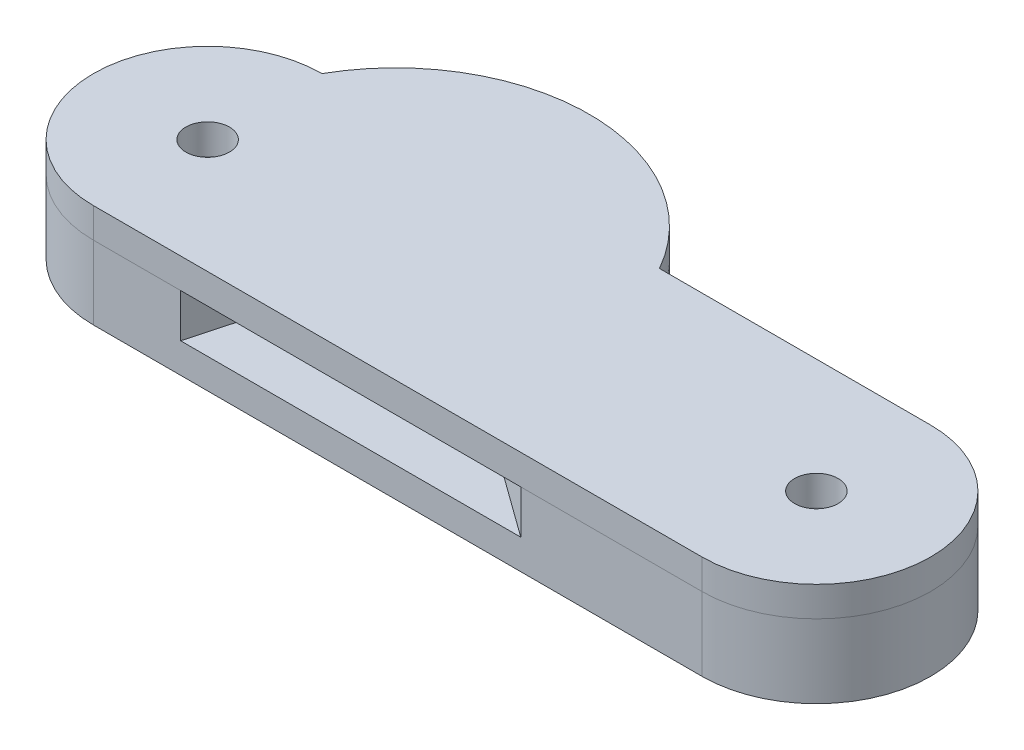
from build123d import *

# Parameters (mm, degrees)
SKETCH1_R                       = 2
BOSS_EXTRUDE1_DEPTH             = 4.75
CUT_EXTRUDE1_DEPTH              = 2
BOSS_EXTRUDE2_REACH             = 69.423
BOSS_EXTRUDE2_DIRECTION_2_REACH = 69.423
CUT_EXTRUDE2_DEPTH              = 2


with BuildPart() as part:
    # Sketch1 → Boss-Extrude1 (new, symmetric)
    with BuildSketch(Plane(origin=(0, 0, 0), x_dir=(1, 0, 0), z_dir=(0, 1, 0))):
        with BuildLine():
            Line((0, -10.500399217), (-55.93053828, -10.500399217))
            ThreePointArc((-55.93053828, -10.500399217), (-66.430937497, 0), (-55.93053828, 10.500399217))
            Line((-55.93053828, 10.500399217), (0, 10.500399217))
            ThreePointArc((0, 10.500399217), (10.500399217, 0), (0, -10.500399217))
        make_face()
        with Locations(Location((0, 0, 0), (0, 0, 270))):
            Circle(SKETCH1_R, mode=Mode.SUBTRACT)
        with Locations(Location((-55.93053828, 0, 0), (0, 0, 270))):
            Circle(SKETCH1_R, mode=Mode.SUBTRACT)
    extrude(amount=BOSS_EXTRUDE1_DEPTH, both=True)

    # Sketch3 → Cut-Extrude1 (cut, symmetric)
    with BuildSketch(Plane(origin=(0, 0, 0), x_dir=(1, 0, 0), z_dir=(0, 1, 0))):
        with BuildLine():
            Line((-35.751827911, 18.875253657), (-39.299525946, 5.868950542))
            Line((-39.299525946, 5.868950542), (26.645239155, -41.810424095))
            ThreePointArc((26.645239155, -41.810424095), (-18.563858299, -45.972421055), (-48.206523525, -11.584965354))
            Line((-48.206523525, -11.584965354), (-43.887265107, 4.249974277))
            Line((-43.887265107, 4.249974277), (-54.812276631, 12.148974547))
            ThreePointArc((-54.812276631, 12.148974547), (-46.585078234, 19.204535889), (-35.751827911, 18.875253657))
        make_face()
    extrude(amount=CUT_EXTRUDE1_DEPTH, both=True, mode=Mode.SUBTRACT)

    # Boss-Extrude2: up to this face of the body (flat: up to its plane)
    boss_extrude2_end = Plane(part.part.faces().sort_by_distance((-27.96526914, 4.75, 0))[0])
    # Sketch5 → Boss-Extrude2 (add, up to the picked face)
    with BuildSketch(Plane(origin=(0, 0, 0), x_dir=(1, 0, 0), z_dir=(0, 1, 0)), mode=Mode.PRIVATE) as boss_extrude2_sk1:
        with BuildLine():
            ThreePointArc((-24.917700351, 10.500399217), (-40.424119316, 19.553005923), (-55.93053828, 10.500399217))
            Line((-55.93053828, 10.500399217), (-24.917700351, 10.500399217))
        make_face()
    boss_extrude2_tool1 = split(extrude(boss_extrude2_sk1.sketch, amount=BOSS_EXTRUDE2_REACH, mode=Mode.PRIVATE), bisect_by=boss_extrude2_end, keep=Keep.BOTH, mode=Mode.PRIVATE)
    add(boss_extrude2_tool1.solids().sort_by(Axis((-40.424119, 0, -14.214125), (0, 1, 0)))[0])

    # Boss-Extrude2 direction 2: up to this face of the body (flat: up to its plane)
    boss_extrude2_direction_2_end = Plane(part.part.faces().sort_by_distance((-27.96526914, -4.75, 0))[0])
    # Sketch5 → Boss-Extrude2 direction 2 (add, up to the picked face)
    with BuildSketch(Plane(origin=(0, 0, 0), x_dir=(1, 0, 0), z_dir=(0, 1, 0)), mode=Mode.PRIVATE) as boss_extrude2_direction_2_sk1:
        with BuildLine():
            ThreePointArc((-24.917700351, 10.500399217), (-40.424119316, 19.553005923), (-55.93053828, 10.500399217))
            Line((-55.93053828, 10.500399217), (-24.917700351, 10.500399217))
        make_face()
    boss_extrude2_direction_2_tool1 = split(extrude(boss_extrude2_direction_2_sk1.sketch, amount=-BOSS_EXTRUDE2_DIRECTION_2_REACH, mode=Mode.PRIVATE), bisect_by=boss_extrude2_direction_2_end, keep=Keep.BOTH, mode=Mode.PRIVATE)
    add(boss_extrude2_direction_2_tool1.solids().sort_by(Axis((-40.424119, 0, -14.214125), (0, -1, 0)))[0])

    # Sketch6 → Cut-Extrude2 (cut, symmetric)
    with BuildSketch(Plane(origin=(0, 0, 0), x_dir=(1, 0, 0), z_dir=(0, 1, 0))):
        with BuildLine():
            Line((-39.299525946, 5.868950542), (-16.659276721, -10.500399217))
            Line((-16.659276721, -10.500399217), (-47.910689027, -10.500399217))
            Line((-47.910689027, -10.500399217), (-43.887265107, 4.249974277))
            Line((-43.887265107, 4.249974277), (-54.854382526, 12.179417945))
            ThreePointArc((-54.854382526, 12.179417945), (-46.349897212, 18.538096729), (-35.738154791, 18.925381021))
            Line((-35.738154791, 18.925381021), (-39.299525946, 5.868950542))
        make_face()
    extrude(amount=CUT_EXTRUDE2_DEPTH, both=True, mode=Mode.SUBTRACT)


with BuildPart() as body_2:
    # Split1: the piece on the far side of the plane
    add(part.part)
    split(bisect_by=Plane(origin=(0, 2, 0), x_dir=(0, 0, -1), z_dir=(0, -1, 0)), keep=Keep.BOTTOM)


with BuildPart() as part_1:
    add(part.part)

    # Split1
    split(bisect_by=Plane(origin=(0, 2, 0), x_dir=(0, 0, -1), z_dir=(0, -1, 0)), keep=Keep.TOP)


solid = Compound([body_2.part, part_1.part])
